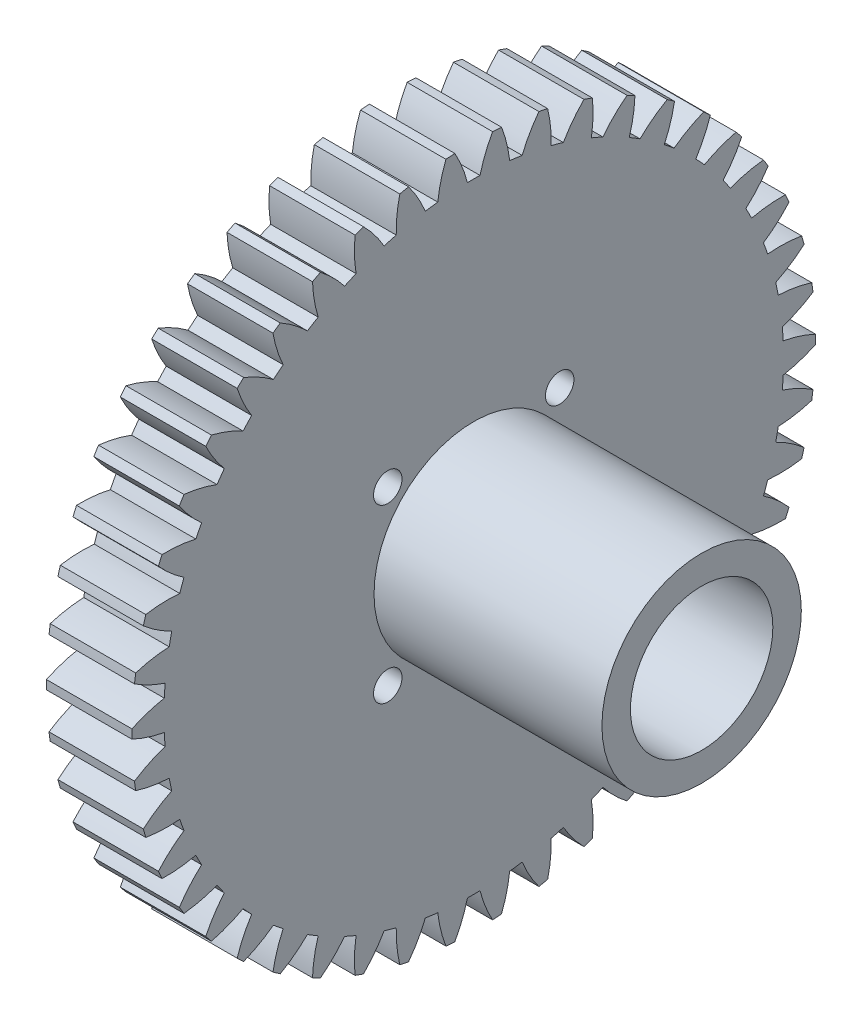
from build123d import *

# Parameters (mm, degrees)
BASPROSKE_W         = 6
BASPROSKE_H         = 24
TOOTHCUT_DEPTH      = 35.467375879
TEETHCUTS_COUNT     = 46
TEETHCUTS_ANGLE     = 352.173913043
SKETCH1_R           = 1
CUT_EXTRUDE1_DEPTH  = 35.441921671
SKETCH2_R           = 7
SKETCH2_R_2         = 5
BOSS_EXTRUDE1_DEPTH = 16


with BuildPart() as part:
    # BasProSke → Base-Revolve (revolve)
    with BuildSketch(Plane(origin=(0, 0, 0), x_dir=(1, 0, 0), z_dir=(0, 1, 0)), mode=Mode.PRIVATE) as base_revolve_sk:
        with Locations((3, 12)):
            Rectangle(BASPROSKE_W, BASPROSKE_H)
    revolve(base_revolve_sk.sketch.rotate(Axis((-10, 0, 0), (1, 0, 0)), 180), axis=Axis((-10, 0, 0), (1, 0, 0)))

    # TooCutSke → ToothCut (cut, through all)
    with BuildSketch(Plane(origin=(0, 0, 0), x_dir=(0, 0, -1), z_dir=(1, 0, 0))):
        with BuildLine():
            ThreePointArc((0.441526923, 21.744517814), (0, 21.749), (-0.441526923, 21.744517814))
            ThreePointArc((-0.441526923, 21.744517814), (-0.815896613, 22.895874179), (-1.338211282, 23.988101962))
            ThreePointArc((-1.338211282, 23.988101962), (0, 24.0254), (1.338211282, 23.988101962))
            ThreePointArc((1.338211282, 23.988101962), (0.815896613, 22.895874179), (0.441526923, 21.744517814))
        make_face()
    toothcut = extrude(amount=TOOTHCUT_DEPTH, mode=Mode.SUBTRACT)

    # TeethCuts: ToothCut ×46 about axis
    teethcuts_axis = Axis((-10, 0, 0), (1, 0, 0))
    for i in range(1, TEETHCUTS_COUNT):
        add(toothcut.rotate(teethcuts_axis, i * TEETHCUTS_ANGLE / (TEETHCUTS_COUNT - 1)), mode=Mode.SUBTRACT)

    # Sketch1 → Cut-Extrude1 (cut, through all)
    with BuildSketch(Plane(origin=(6, 0, 0), x_dir=(0, 0, -1), z_dir=(1, 0, 0))):
        with Locations((-6.035, 6.035)):
            Circle(SKETCH1_R)
        with Locations((6.035, 6.035)):
            Circle(SKETCH1_R)
        with Locations((6.035, -6.035)):
            Circle(SKETCH1_R)
        with Locations((-6.035, -6.035)):
            Circle(SKETCH1_R)
    extrude(amount=-CUT_EXTRUDE1_DEPTH, mode=Mode.SUBTRACT)

    # Sketch2 → Boss-Extrude1 (add)
    with BuildSketch(Plane(origin=(6, 0, 0), x_dir=(0, 0, -1), z_dir=(1, 0, 0))):
        with Locations(Location((0, 0, 0), (0, 0, 180))):
            Circle(SKETCH2_R)
        Circle(SKETCH2_R_2, mode=Mode.SUBTRACT)
    extrude(amount=BOSS_EXTRUDE1_DEPTH)


solid = part.part
